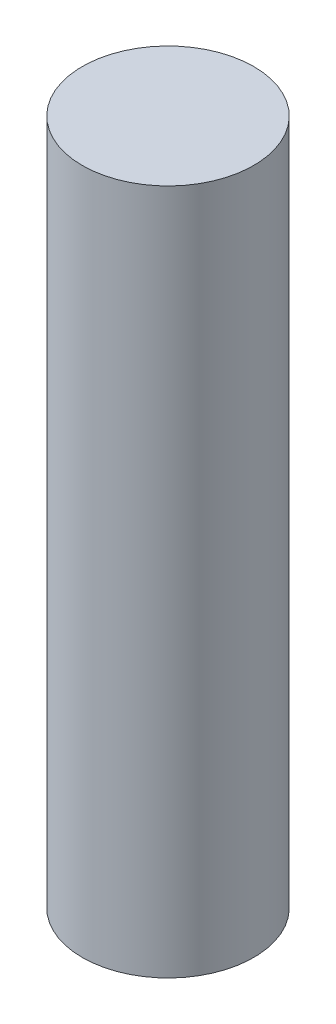
from build123d import *

# Parameters (mm, degrees)
SKETCH2_R           = 5
BOSS_EXTRUDE1_DEPTH = 40


with BuildPart() as part:
    # Sketch2 → Boss-Extrude1 (new body)
    with BuildSketch(Plane(origin=(0, 0, 0), x_dir=(1, 0, 0), z_dir=(0, 1, 0))):
        with Locations(Location((0, 0, 0), (0, 0, 270))):
            Circle(SKETCH2_R)
    extrude(amount=BOSS_EXTRUDE1_DEPTH)


solid = part.part
